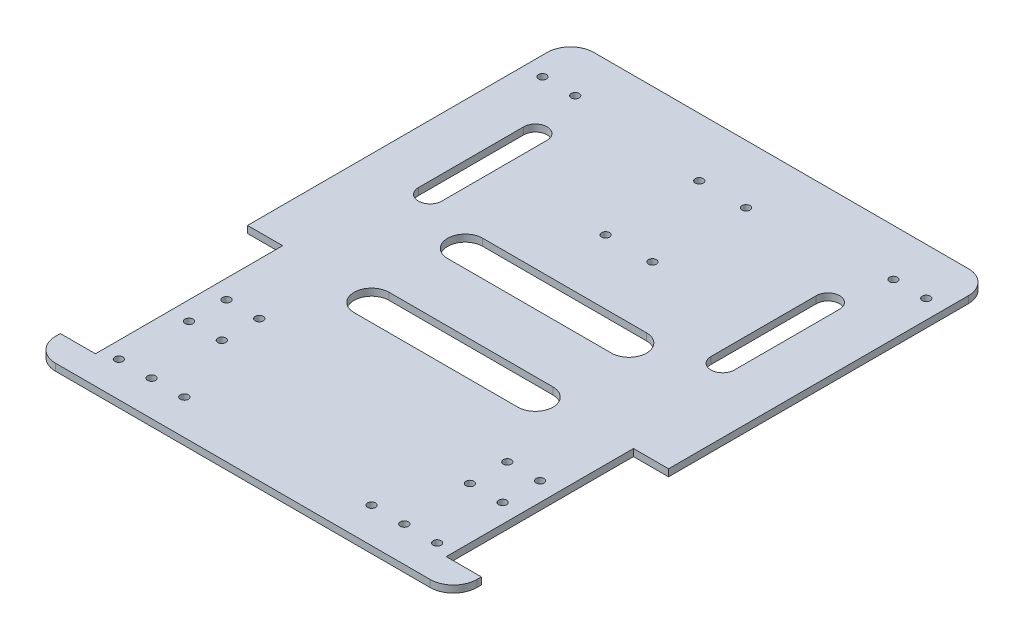
from build123d import *

# Parameters (mm, degrees)
SKETCH1_W           = 180
SKETCH1_H           = 230
BOSS_EXTRUDE1_DEPTH = 3
FILLET1_R           = 10
SKETCH2_R           = 1.7
CUT_EXTRUDE1_DEPTH  = 3
SKETCH3_R           = 1.7
CUT_EXTRUDE2_DEPTH  = 3
SKETCH7_W           = 30
SKETCH7_H           = 80
CUT_EXTRUDE7_DEPTH  = 167.460205455
CUT_EXTRUDE8_DEPTH  = 167.460205455


with BuildPart() as part:
    # Sketch1 → Boss-Extrude1 (new body)
    with BuildSketch(Plane(origin=(0, 0, 0), x_dir=(1, 0, 0), z_dir=(0, 1, 0))):
        with Locations((0, 25)):
            Rectangle(SKETCH1_W, SKETCH1_H)
    extrude(amount=BOSS_EXTRUDE1_DEPTH)

    # Fillet1
    fillet1_edges = [part.edges().sort_by_distance(p)[0] for p in [
        (90, 1.5, 90),
        (-90, 1.5, 90),
        (-90, 1.5, -140),
        (90, 1.5, -140),
    ]]
    fillet(fillet1_edges, radius=FILLET1_R)

    # Sketch2 → Cut-Extrude1 (cut)
    with BuildSketch(Plane(origin=(0, 3, 0), x_dir=(1, 0, 0), z_dir=(0, 1, 0))):
        with Locations(Location((-82, 120, 0), (0, 0, 270))):
            Circle(SKETCH2_R)
        with Locations(Location((-68, 120, 0), (0, 0, 270))):
            Circle(SKETCH2_R)
        with Locations(Location((68, 120, 0), (0, 0, 270))):
            Circle(SKETCH2_R)
        with Locations(Location((82, 120, 0), (0, 0, 270))):
            Circle(SKETCH2_R)
        with Locations(Location((-82, -75, 0), (0, 0, 270))):
            Circle(SKETCH2_R)
        with Locations(Location((-68, -75, 0), (0, 0, 270))):
            Circle(SKETCH2_R)
        with Locations(Location((68, -75, 0), (0, 0, 270))):
            Circle(SKETCH2_R)
        with Locations(Location((82, -75, 0), (0, 0, 270))):
            Circle(SKETCH2_R)
        with Locations(Location((-67, -30, 0), (0, 0, 270))):
            Circle(SKETCH2_R)
        with Locations(Location((-67, -46, 0), (0, 0, 270))):
            Circle(SKETCH2_R)
        with Locations(Location((-53, -30, 0), (0, 0, 270))):
            Circle(SKETCH2_R)
        with Locations(Location((-53, -46, 0), (0, 0, 270))):
            Circle(SKETCH2_R)
        with Locations(Location((53, -30, 0), (0, 0, 270))):
            Circle(SKETCH2_R)
        with Locations(Location((53, -46, 0), (0, 0, 270))):
            Circle(SKETCH2_R)
        with Locations(Location((67, -30, 0), (0, 0, 270))):
            Circle(SKETCH2_R)
        with Locations(Location((67, -46, 0), (0, 0, 270))):
            Circle(SKETCH2_R)
        with Locations(Location((-54, -75, 0), (0, 0, 270))):
            Circle(SKETCH2_R)
        with Locations(Location((54, -75, 0), (0, 0, 270))):
            Circle(SKETCH2_R)
        with Locations(Location((-40, -75, 0), (0, 0, 270))):
            Circle(SKETCH2_R)
        with Locations(Location((40, -75, 0), (0, 0, 270))):
            Circle(SKETCH2_R)
    extrude(amount=-CUT_EXTRUDE1_DEPTH, mode=Mode.SUBTRACT)

    # Sketch3 → Cut-Extrude2 (cut)
    with BuildSketch(Plane(origin=(0, 3, 0), x_dir=(1, 0, 0), z_dir=(0, 1, 0))):
        with Locations(Location((10, 75, 0), (0, 0, 270))):
            Circle(SKETCH3_R)
        with Locations(Location((-10, 75, 0), (0, 0, 270))):
            Circle(SKETCH3_R)
        with Locations(Location((-10, 115, 0), (0, 0, 270))):
            Circle(SKETCH3_R)
        with Locations(Location((10, 115, 0), (0, 0, 270))):
            Circle(SKETCH3_R)
    extrude(amount=-CUT_EXTRUDE2_DEPTH, mode=Mode.SUBTRACT)

    # Sketch7 → Cut-Extrude7 (cut, through all)
    with BuildSketch(Plane(origin=(0, 3, 0), x_dir=(1, 0, 0), z_dir=(0, 1, 0))):
        with Locations((-90, -38)):
            Rectangle(SKETCH7_W, SKETCH7_H)
        with Locations((90, -38.099840659)):
            Rectangle(SKETCH7_W, SKETCH7_H)
    extrude(amount=-CUT_EXTRUDE7_DEPTH, mode=Mode.SUBTRACT)

    # Sketch8 → Cut-Extrude8 (cut, through all)
    with BuildSketch(Plane(origin=(0, 3, 0), x_dir=(1, 0, 0), z_dir=(0, 1, 0))):
        with BuildLine():
            Line((-35, 47.5), (35, 47.5))
            ThreePointArc((35, 47.5), (42.5, 40), (35, 32.5))
            Line((35, 32.5), (-35, 32.5))
            ThreePointArc((-35, 32.5), (-42.5, 40), (-35, 47.5))
        make_face()
        with BuildLine():
            Line((-35, 7.5), (35, 7.5))
            ThreePointArc((35, 7.5), (42.5, 0), (35, -7.5))
            Line((35, -7.5), (-35, -7.5))
            ThreePointArc((-35, -7.5), (-42.5, 0), (-35, 7.5))
        make_face()
        with BuildLine():
            Line((-57.5, 97.5), (-57.5, 52.5))
            ThreePointArc((-57.5, 52.5), (-62.5, 47.5), (-67.5, 52.5))
            Line((-67.5, 52.5), (-67.5, 97.5))
            ThreePointArc((-67.5, 97.5), (-62.5, 102.5), (-57.5, 97.5))
        make_face()
        with BuildLine():
            Line((67.5, 97.5), (67.5, 52.5))
            ThreePointArc((67.5, 52.5), (62.5, 47.5), (57.5, 52.5))
            Line((57.5, 52.5), (57.5, 97.5))
            ThreePointArc((57.5, 97.5), (62.5, 102.5), (67.5, 97.5))
        make_face()
    extrude(amount=-CUT_EXTRUDE8_DEPTH, mode=Mode.SUBTRACT)


solid = part.part
